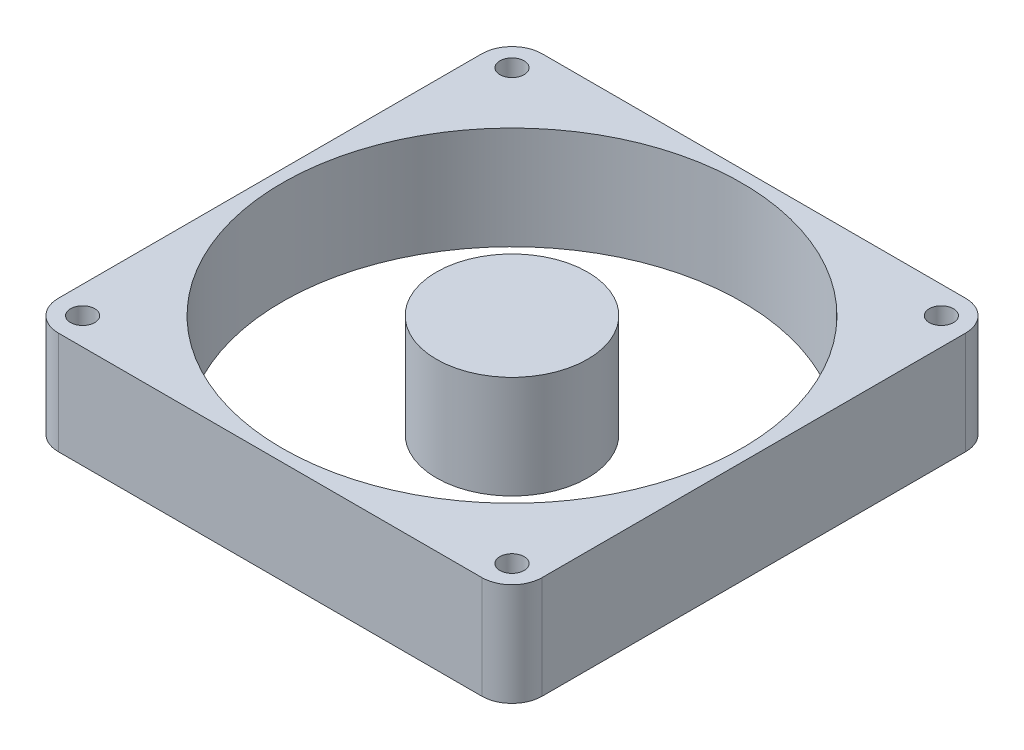
from build123d import *

# Parameters (mm, degrees)
EXTRUDE_1_DEPTH     = 17
SKETCH_2_R          = 12.5
CUT_EXTRUDE_1_DEPTH = 17
SKETCH_3_R          = 38
EXTRUDE_3_DEPTH     = 17
SKETCH_4_R          = 2
CUT_EXTRUDE_2_DEPTH = 17


with BuildPart() as part:
    # 草图1 → 拉伸1 (new body)
    with BuildSketch(Plane(origin=(0, 0, 0), x_dir=(1, 0, 0), z_dir=(0, 1, 0))):
        with BuildLine():
            Line((-35, 40), (35, 40))
            ThreePointArc((35, 40), (38.535533906, 38.535533906), (40, 35))
            Line((40, 35), (40, -35))
            ThreePointArc((40, -35), (38.535533906, -38.535533906), (35, -40))
            Line((35, -40), (-35, -40))
            ThreePointArc((-35, -40), (-38.535533906, -38.535533906), (-40, -35))
            Line((-40, -35), (-40, 35))
            ThreePointArc((-40, 35), (-38.535533906, 38.535533906), (-35, 40))
        make_face()
    extrude(amount=EXTRUDE_1_DEPTH)

    # 草图2 → 切除-拉伸1 (cut)
    with BuildSketch(Plane(origin=(0, 17, 0), x_dir=(-1, 0, 0), z_dir=(0, 1, 0))):
        with BuildLine():
            Line((-35, -38), (35, -38))
            ThreePointArc((35, -38), (37.121320344, -37.121320344), (38, -35))
            Line((38, -35), (38, 35))
            ThreePointArc((38, 35), (37.121320344, 37.121320344), (35, 38))
            Line((35, 38), (-35, 38))
            ThreePointArc((-35, 38), (-37.121320344, 37.121320344), (-38, 35))
            Line((-38, 35), (-38, -35))
            ThreePointArc((-38, -35), (-37.121320344, -37.121320344), (-35, -38))
        make_face()
        with Locations(Location((0, 0, 0), (0, 0, 90))):
            Circle(SKETCH_2_R, mode=Mode.SUBTRACT)
    extrude(amount=-CUT_EXTRUDE_1_DEPTH, mode=Mode.SUBTRACT)


with BuildPart() as cut_extrude_1_piece_1:
    # of the separate pieces the step leaves, piece 1, a body of its own (cut_extrude_1_pieces)
    add(part.part.solids().sort_by_distance((-35, 0, -40))[0])

    # 草图3 → 拉伸3 (add)
    with BuildSketch(Plane(origin=(0, 17, 0), x_dir=(-1, 0, 0), z_dir=(0, 1, 0))):
        with BuildLine():
            Line((40, -35), (40, 35))
            ThreePointArc((40, 35), (38.535533906, 38.535533906), (35, 40))
            Line((35, 40), (-35, 40))
            ThreePointArc((-35, 40), (-38.535533906, 38.535533906), (-40, 35))
            Line((-40, 35), (-40, -35))
            ThreePointArc((-40, -35), (-38.535533906, -38.535533906), (-35, -40))
            Line((-35, -40), (35, -40))
            ThreePointArc((35, -40), (38.535533906, -38.535533906), (40, -35))
        make_face()
        with Locations(Location((0, 0, 0), (0, 0, 90))):
            Circle(SKETCH_3_R, mode=Mode.SUBTRACT)
    extrude(amount=-EXTRUDE_3_DEPTH)

    # 草图4 → 切除-拉伸2 (cut)
    with BuildSketch(Plane(origin=(0, 17, 0), x_dir=(-1, 0, 0), z_dir=(0, 1, 0))):
        with Locations(Location((-35.5, -35.5, 0), (0, 0, 90))):
            Circle(SKETCH_4_R)
        with Locations(Location((-35.5, 35.5, 0), (0, 0, 90))):
            Circle(SKETCH_4_R)
        with Locations(Location((35.5, 35.5, 0), (0, 0, 90))):
            Circle(SKETCH_4_R)
        with Locations(Location((35.5, -35.5, 0), (0, 0, 90))):
            Circle(SKETCH_4_R)
    extrude(amount=-CUT_EXTRUDE_2_DEPTH, mode=Mode.SUBTRACT)


with BuildPart() as cut_extrude_1_piece_2:
    # of the separate pieces the step leaves, piece 2, a body of its own (cut_extrude_1_pieces)
    add(part.part.solids().sort_by_distance((0, 0, 12.5))[0])


solid = Compound([cut_extrude_1_piece_1.part, cut_extrude_1_piece_2.part])
